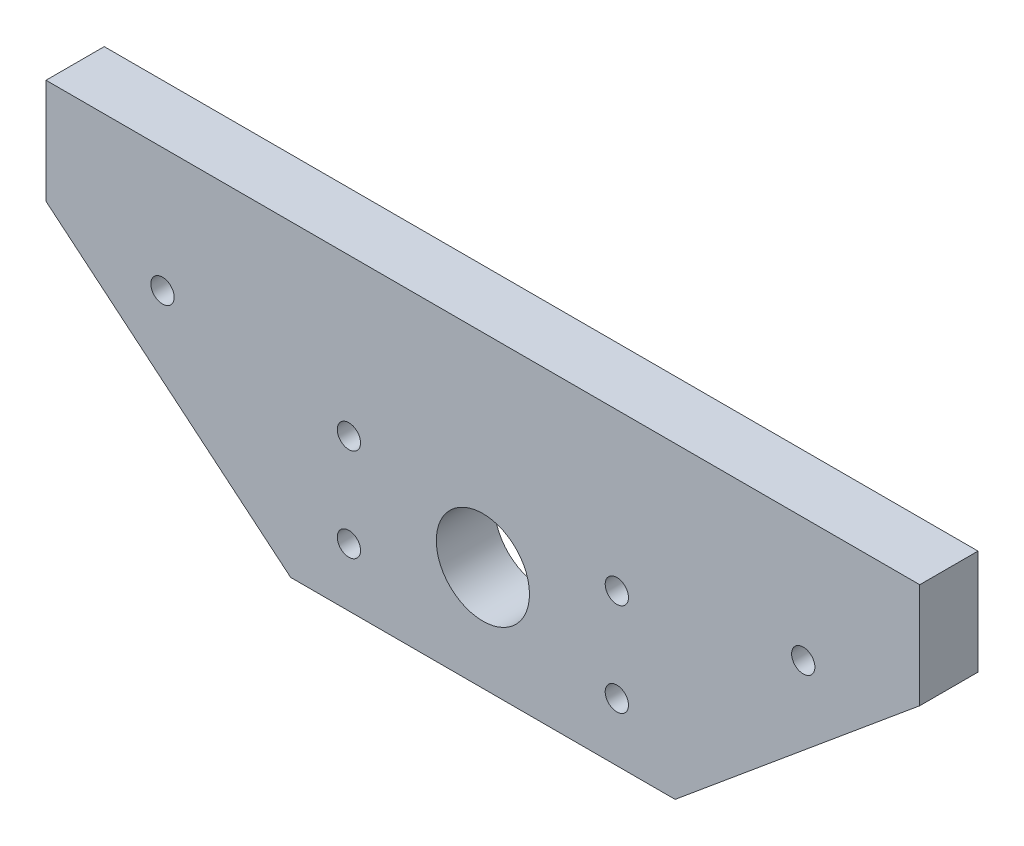
from build123d import *

# Parameters (mm, degrees)
SKETCH_1_W          = 150
SKETCH_1_H          = 70
EXTRUDE_1_DEPTH     = 10
SKETCH_2_R          = 8
CUT_EXTRUDE_1_DEPTH = 84.400624887
SKETCH_3_R          = 2
CUT_EXTRUDE_2_DEPTH = 84.400624887
SKETCH_4_R          = 2
CUT_EXTRUDE_3_DEPTH = 84.400624887
CUT_EXTRUDE_4_DEPTH = 84.400624887


with BuildPart() as part:
    # 스케치1 → 보스-돌출1 (new body)
    with BuildSketch(Plane.XY):
        with Locations((0, -0.080824272)):
            Rectangle(SKETCH_1_W, SKETCH_1_H)
    extrude(amount=EXTRUDE_1_DEPTH)

    # 스케치2 → 컷-돌출1 (cut, through all)
    with BuildSketch(Plane.XY.offset(10)):
        Circle(SKETCH_2_R)
    extrude(amount=-CUT_EXTRUDE_1_DEPTH, mode=Mode.SUBTRACT)

    # 스케치3 → 컷-돌출2 (cut, through all)
    with BuildSketch(Plane.XY.offset(10)):
        with Locations((-23, 8)):
            Circle(SKETCH_3_R)
        with Locations(Location((-23, -8, 0), (0, 0, 180))):
            Circle(SKETCH_3_R)
        with Locations((23, -8)):
            Circle(SKETCH_3_R)
        with Locations(Location((23, 8, 0), (0, 0, 180))):
            Circle(SKETCH_3_R)
    extrude(amount=-CUT_EXTRUDE_2_DEPTH, mode=Mode.SUBTRACT)

    # 스케치4 → 컷-돌출3 (cut, through all)
    with BuildSketch(Plane.XY.offset(10)):
        with Locations((-55, 13.64900919)):
            Circle(SKETCH_4_R)
        with Locations((-65, -25.080824272)):
            Circle(SKETCH_4_R)
        with Locations(Location((65, -25.080824272, 0), (0, 0, 180))):
            Circle(SKETCH_4_R)
        with Locations(Location((55, 13.64900919, 0), (0, 0, 180))):
            Circle(SKETCH_4_R)
    extrude(amount=-CUT_EXTRUDE_3_DEPTH, mode=Mode.SUBTRACT)

    # 스케치5 → 컷-돌출4 (cut, through all)
    with BuildSketch(Plane.XY.offset(10)):
        Polygon((-75, 16.919175728), (-33, -18), (33, -18), (75, 16.919175728), (75, -35.080824272), (-75, -35.080824272), (-75, -27.080824272), align=None)
    extrude(amount=-CUT_EXTRUDE_4_DEPTH, mode=Mode.SUBTRACT)


solid = part.part
